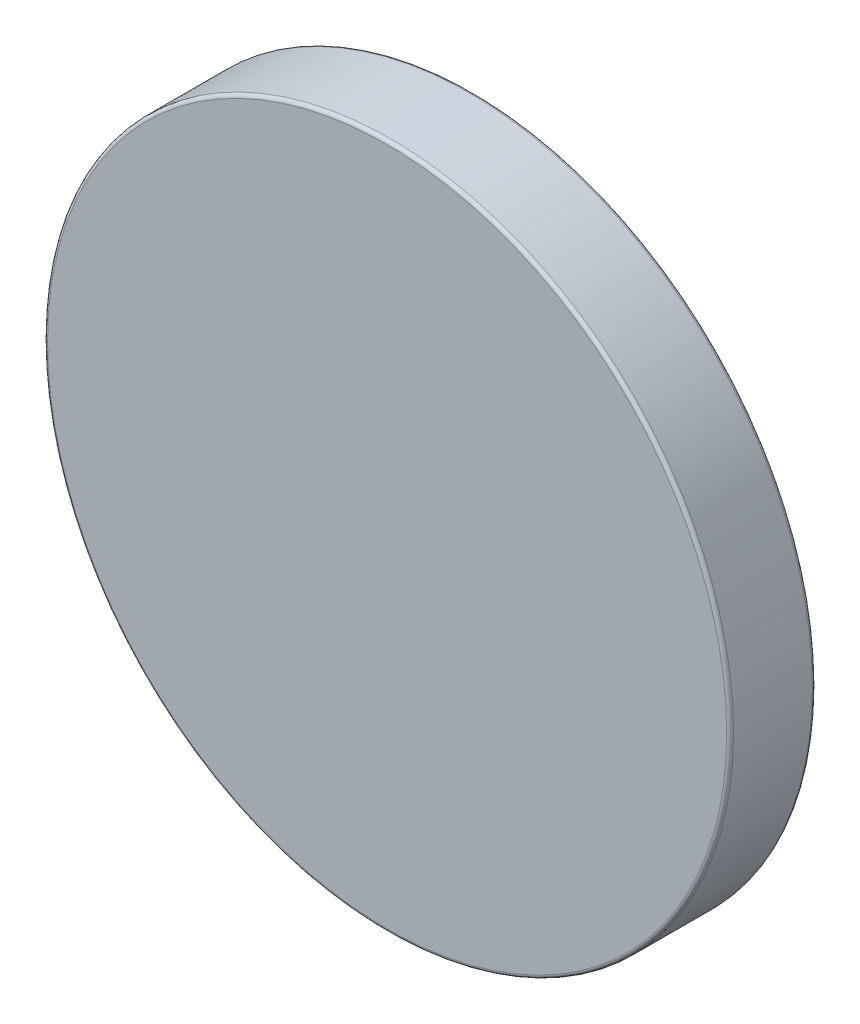
from build123d import *

# Parameters (mm, degrees)
BOSS_EXTRUDE1_DEPTH      = 1.5875
BOSS_EXTRUDE1_DEPTH_BACK = 1.5875
SKETCH3_R                = 12.7
FILLET1_R                = 0.127


with BuildPart() as part:
    # Sketch3 → Boss-Extrude1 (new, two sides: drawn at the far end of the back side and taken through both)
    with BuildSketch(Plane.XY.offset(-BOSS_EXTRUDE1_DEPTH_BACK)):
        Circle(SKETCH3_R)
    extrude(amount=BOSS_EXTRUDE1_DEPTH + BOSS_EXTRUDE1_DEPTH_BACK)

    # Fillet1
    fillet1_edges = [part.edges().sort_by_distance(p)[0] for p in [
        (-12.7, 0, -1.5875),
        (-12.7, 0, 1.5875),
    ]]
    fillet(fillet1_edges, radius=FILLET1_R)


solid = part.part
